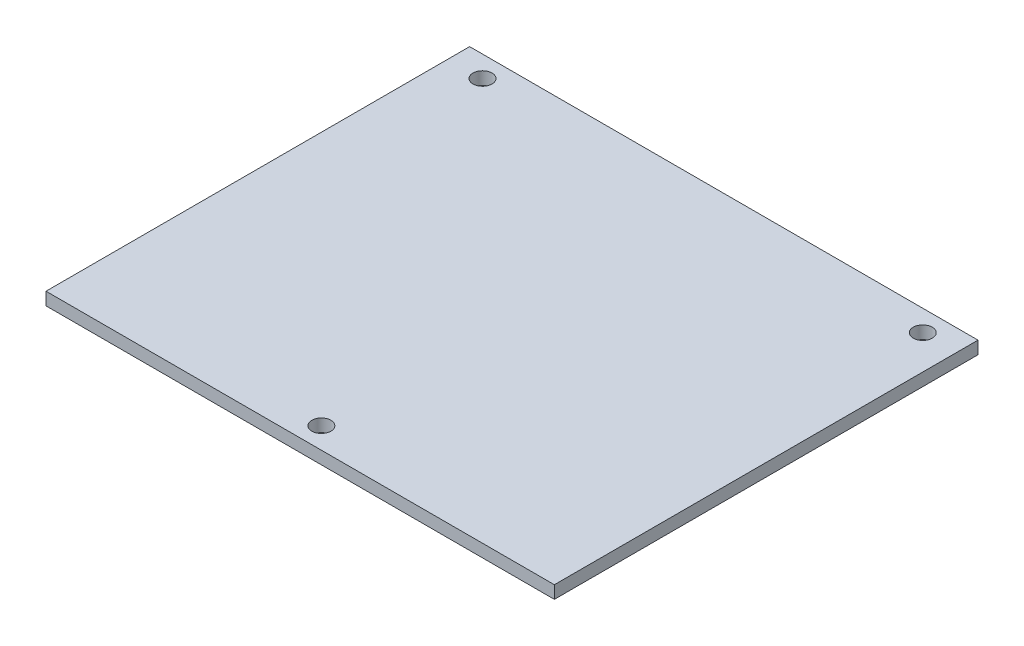
from build123d import *

# Parameters (mm, degrees)
SKETCH_1_W             = 120
SKETCH_1_H             = 100
EXTRUDE_1_DEPTH        = 3
HOLE_WIZARD_M4_1_D     = 4.5
HOLE_WIZARD_M4_1_DEPTH = 20
HOLE_WIZARD_M4_1_TIP   = 1.351936393


with BuildPart() as part:
    # 스케치1 → 보스-돌출1 (new body)
    with BuildSketch(Plane(origin=(0, 0, 0), x_dir=(1, 0, 0), z_dir=(0, 1, 0))):
        with Locations((60, 50)):
            Rectangle(SKETCH_1_W, SKETCH_1_H)
    extrude(amount=EXTRUDE_1_DEPTH)

    # M4 여유 구멍1
    with Locations(Plane(origin=(0, 3, 0), x_dir=(1, 0, 0), z_dir=(0, 1, 0))):
        with Locations((8.038475773, 95), (111.961524227, 95), (60, 5)):
            Hole(HOLE_WIZARD_M4_1_D / 2, depth=HOLE_WIZARD_M4_1_DEPTH)
            with Locations((0, 0, -(HOLE_WIZARD_M4_1_DEPTH + HOLE_WIZARD_M4_1_TIP / 2))):  # 118° drill point
                Cone(0, HOLE_WIZARD_M4_1_D / 2, HOLE_WIZARD_M4_1_TIP, mode=Mode.SUBTRACT)


solid = part.part
